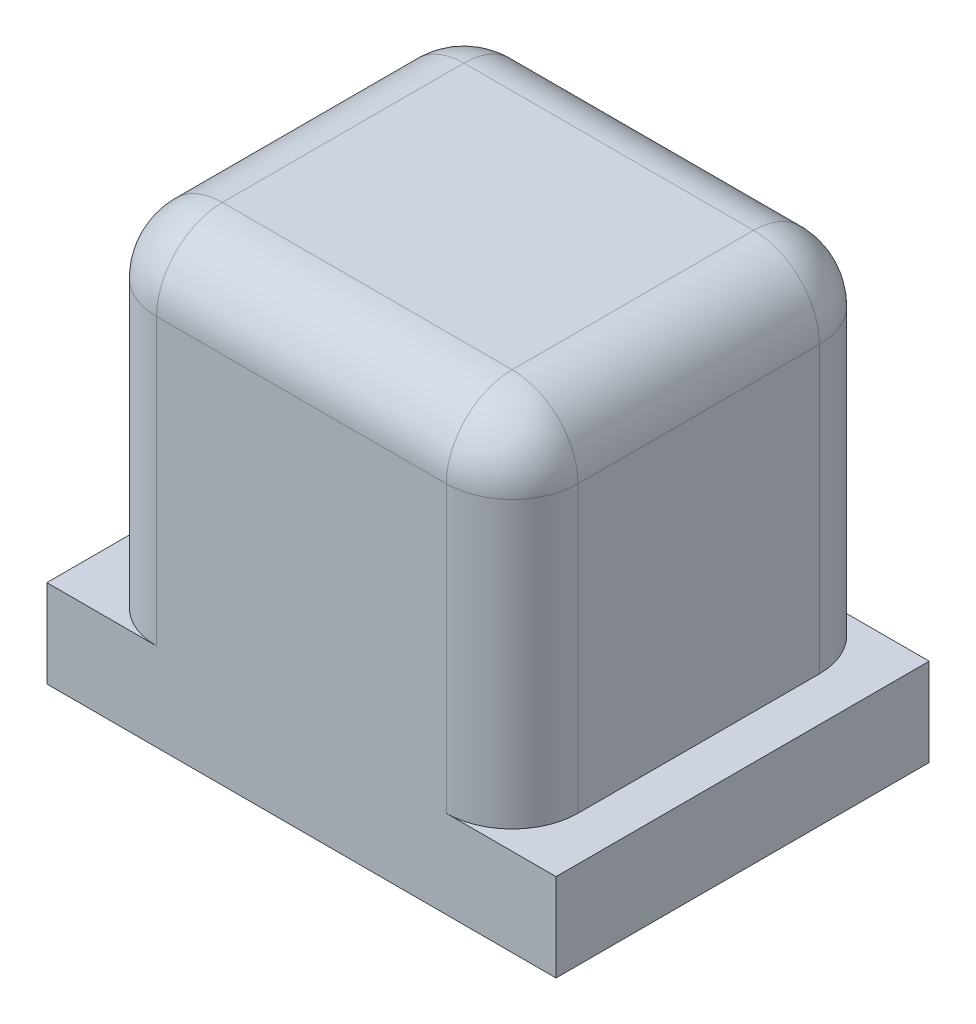
from build123d import *

# Parameters (mm, degrees)
SKETCH2_W           = 1
SKETCH2_H           = 2
BOSS_EXTRUDE1_DEPTH = 8.5
FILLET1_R           = 1.5


with BuildPart() as part:
    # Sketch2 → Boss-Extrude1 (new body)
    with BuildSketch(Plane.XY):
        Polygon((-2.95, 55.75), (-7.75, 55.75), (-7.75, 45.75), (-2.95, 45.75), (-2.95, 47.75), align=None)
        Polygon((-7.75, 55.75), (-12.55, 55.75), (-12.55, 47.75), (-12.55, 45.75), (-7.75, 45.75), align=None)
        with Locations((-2.45, 46.75)):
            Rectangle(SKETCH2_W, SKETCH2_H)
        with Locations((-13.05, 46.75)):
            Rectangle(SKETCH2_W, SKETCH2_H)
    extrude(amount=BOSS_EXTRUDE1_DEPTH)

    # Fillet1
    fillet1_edges = [part.edges().sort_by_distance(p)[0] for p in [
        (-2.95, 51.75, 0),
        (-12.55, 51.75, 8.5),
        (-12.55, 51.75, 0),
        (-7.75, 55.75, 0),
        (-2.95, 55.75, 4.25),
        (-12.55, 55.75, 4.25),
        (-2.95, 51.75, 8.5),
        (-7.75, 55.75, 8.5),
    ]]
    fillet(fillet1_edges, radius=FILLET1_R)


solid = part.part
